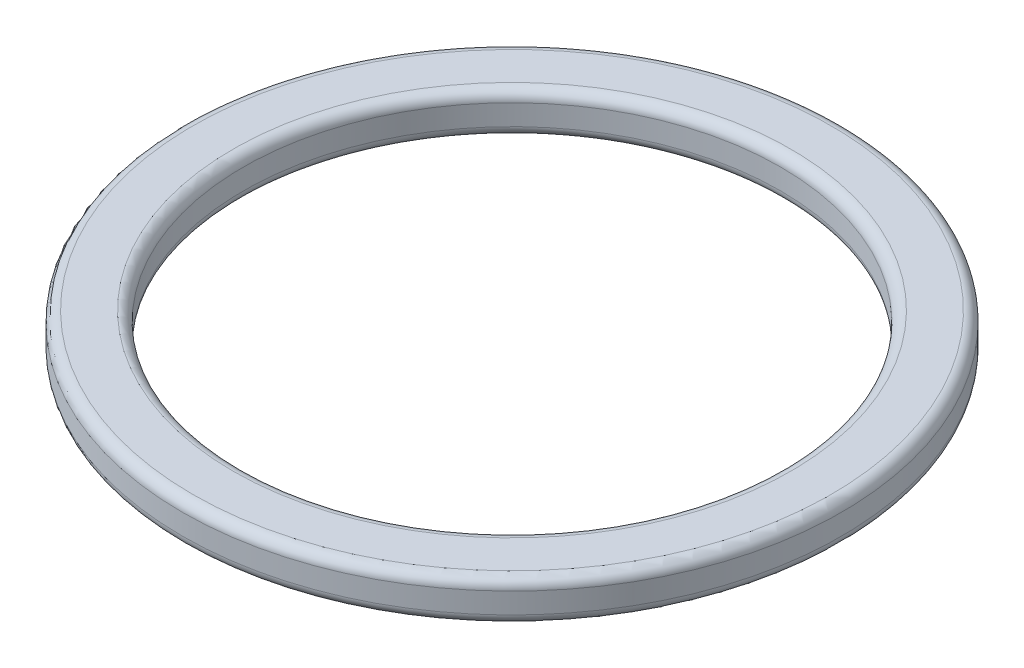
from build123d import *

# Parameters (mm, degrees)
SKETCH1_R           = 15.95
SKETCH1_R_2         = 13
BOSS_EXTRUDE1_DEPTH = 2
FILLET1_R           = 0.5


with BuildPart() as part:
    # Sketch1 → Boss-Extrude1 (new body)
    with BuildSketch(Plane(origin=(0, 0, 0), x_dir=(1, 0, 0), z_dir=(0, 1, 0))):
        with Locations(Location((0, 0, 0), (0, 0, 270))):
            Circle(SKETCH1_R)
        with Locations(Location((0, 0, 0), (0, 0, 270))):
            Circle(SKETCH1_R_2, mode=Mode.SUBTRACT)
    extrude(amount=BOSS_EXTRUDE1_DEPTH)

    # Fillet1
    fillet1_edges = [part.edges().sort_by_distance(p)[0] for p in [
        (0, 0, -15.95),
        (0, 2, -15.95),
        (0, 0, -13),
        (0, 2, -13),
    ]]
    fillet(fillet1_edges, radius=FILLET1_R)


solid = part.part
